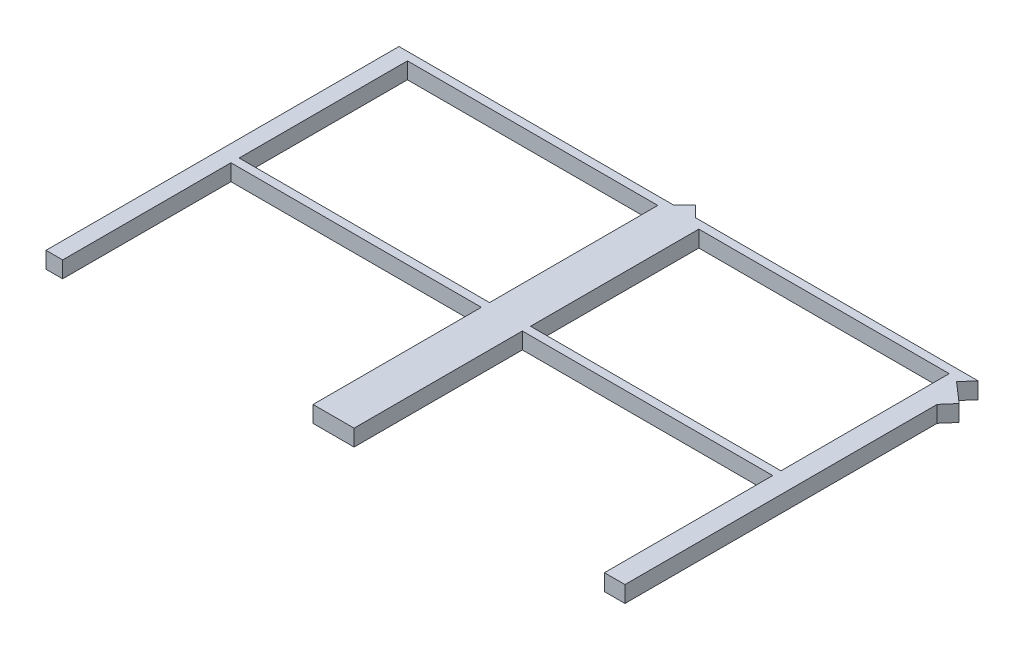
from build123d import *

# Parameters (mm, degrees)
SKETCH1_W           = 77.47
SKETCH1_H           = 52.07
BOSS_EXTRUDE4_DEPTH = 5.08
CUT_EXTRUDE9_DEPTH  = 5.08
CUT_EXTRUDE10_DEPTH = 5.08


with BuildPart() as part:
    # Sketch1 → Boss-Extrude4 (new body)
    with BuildSketch(Plane(origin=(0, 0, 0), x_dir=(1, 0, 0), z_dir=(0, 1, 0))):
        Polygon((-151.207591036, -110.49), (-146.05, -110.49), (-146.05, -58.42), (-68.58, -58.42), (-68.58, -110.49), (-55.88, -110.49), (-55.88, -58.42), (21.59, -58.42), (21.59, -110.49), (34.29, -110.49), (34.29, -58.42), (111.76, -58.42), (111.76, -110.49), (151.052408964, -110.49), (151.052408964, 110.49), (-151.207591036, 110.49), align=None)
        with Locations((-107.315, -29.845)):
            Rectangle(SKETCH1_W, SKETCH1_H, mode=Mode.SUBTRACT)
        with Locations((-17.145, -29.845)):
            Rectangle(SKETCH1_W, SKETCH1_H, mode=Mode.SUBTRACT)
        with Locations((73.025, -29.845)):
            Rectangle(SKETCH1_W, SKETCH1_H, mode=Mode.SUBTRACT)
        with Locations((-107.315, 24.765)):
            Rectangle(SKETCH1_W, SKETCH1_H, mode=Mode.SUBTRACT)
        with Locations((-17.145, 24.765)):
            Rectangle(SKETCH1_W, SKETCH1_H, mode=Mode.SUBTRACT)
        with Locations((-107.315, 79.375)):
            Rectangle(SKETCH1_W, SKETCH1_H, mode=Mode.SUBTRACT)
        with Locations((-17.145, 79.375)):
            Rectangle(SKETCH1_W, SKETCH1_H, mode=Mode.SUBTRACT)
        with Locations((73.025, 24.765)):
            Rectangle(SKETCH1_W, SKETCH1_H, mode=Mode.SUBTRACT)
        with Locations((73.025, 79.375)):
            Rectangle(SKETCH1_W, SKETCH1_H, mode=Mode.SUBTRACT)
    extrude(amount=BOSS_EXTRUDE4_DEPTH)

    # Sketch8 → Cut-Extrude9 (cut)
    # profile 1 of 7: a face of its own
    with BuildSketch(Plane(origin=(0, 5.08, 0), x_dir=(1, 0, 0), z_dir=(0, 1, 0))):
        Polygon((118.11, 79.293589744), (111.76, 76.362820513), (111.76, 76.982301683), (113.79525641, 77.921063702), (113.79525641, 80.799679487), (111.76, 81.765154247), (111.76, 82.387179487), (118.11, 79.375), align=None)
        Polygon((116.872309696, 79.340655048), (114.446538462, 80.49057492), (114.446538462, 78.221264022), align=None, mode=Mode.SUBTRACT)
    # profile 2 of 7: a face of its own
    with BuildSketch(Plane(origin=(0, 5.08, 0), x_dir=(1, 0, 0), z_dir=(0, 1, 0))):
        with BuildLine():
            Line((118.11, 26.474615385), (118.11, 25.235653045))
            add(Edge.make_bspline(
                [(118.11, 25.235653045), (118.109681139, 25.175004234), (118.109063106, 25.057451746), (118.099477996, 24.886510758), (118.086408481, 24.726402202), (118.065671027, 24.577079644), (118.040648803, 24.438612083), (118.010346937, 24.310582227), (117.974012938, 24.193397201), (117.916234684, 24.053492664), (117.830376936, 23.893979465), (117.703506539, 23.721262382), (117.548326213, 23.573571833), (117.37327911, 23.4462338), (117.180718496, 23.344994626), (116.975233967, 23.271753187), (116.75947595, 23.225383899), (116.611351899, 23.220615168), (116.536492388, 23.218205128)],
                knots=[0, 0, 0, 0, 1.001505555, 1.941167018, 2.826882275, 3.653841531, 4.429895133, 5.150066043, 5.825578002, 6.45369114, 7.647487171, 8.808567382, 9.977351308, 11.170798116, 12.373658725, 13.556498008, 14.765093433, 16, 16, 16, 16], degree=3))
            add(Edge.make_bspline(
                [(116.536492388, 23.218205128), (116.466353726, 23.220150205), (116.328524642, 23.223972465), (116.12725909, 23.261767034), (115.934882118, 23.318037757), (115.753765338, 23.399726219), (115.586236491, 23.504802861), (115.433291194, 23.631250472), (115.29863595, 23.781802882), (115.223670167, 23.894781468), (115.185590946, 23.952169471)],
                knots=[0, 0, 0, 0, 1.044266239, 2.052081639, 3.041743201, 4.026043445, 5.00270663, 5.980942822, 6.97441044, 8, 8, 8, 8], degree=3))
            add(Edge.make_bspline(
                [(115.185590946, 23.952169471), (115.157917248, 23.880020614), (115.10497061, 23.741981978), (115.010852235, 23.551885993), (114.90963819, 23.387448746), (114.798522364, 23.248489243), (114.677253559, 23.131437365), (114.548260115, 23.026322349), (114.405191505, 22.938259533), (114.252121508, 22.862606152), (114.090124446, 22.803067733), (113.919941192, 22.760940396), (113.743474705, 22.735055197), (113.623194862, 22.731525492), (113.562473958, 22.72974359)],
                knots=[0, 0, 0, 0, 1.272302504, 2.434229863, 3.488457646, 4.447234501, 5.35599188, 6.26022912, 7.18267843, 8.11661068, 9.06895546, 10.019249207, 11.000057067, 12, 12, 12, 12], degree=3))
            add(Edge.make_bspline(
                [(113.562473958, 22.72974359), (113.500485842, 22.731516424), (113.378522486, 22.735004524), (113.199347436, 22.7607231), (113.028142769, 22.804311677), (112.863691196, 22.864204763), (112.70692357, 22.942816916), (112.555876508, 23.036423505), (112.414573802, 23.150354586), (112.279655118, 23.277346904), (112.158418428, 23.421179366), (112.05048411, 23.576340817), (111.961311987, 23.745062992), (111.887341532, 23.924729456), (111.830014808, 24.116534097), (111.790215937, 24.31976575), (111.763336967, 24.53446858), (111.761131196, 24.681807332), (111.76, 24.757367788)],
                knots=[0, 0, 0, 0, 0.978404568, 1.925038397, 2.85041836, 3.763147166, 4.682162379, 5.614488577, 6.562659439, 7.54271123, 8.535210642, 9.526693784, 10.520907202, 11.541451354, 12.589717429, 13.675358278, 14.807842563, 16, 16, 16, 16], degree=3))
            Line((111.76, 24.757367788), (111.76, 26.474615385))
            Line((111.76, 26.474615385), (118.11, 26.474615385))
        make_face()
        with BuildLine():
            Line((117.458717949, 25.90474359), (115.423461538, 25.90474359))
            Line((115.423461538, 25.90474359), (115.423461538, 25.521860978))
            add(Edge.make_bspline(
                [(115.423461538, 25.521860978), (115.424181075, 25.465891945), (115.425571367, 25.357748368), (115.429679415, 25.200723225), (115.440678409, 25.055331233), (115.452311659, 24.921071395), (115.470224485, 24.798843581), (115.49214475, 24.688238604), (115.515124768, 24.588262886), (115.554315522, 24.473021329), (115.611648095, 24.342338932), (115.702715767, 24.203911992), (115.808237502, 24.079896012), (115.932241327, 23.976344233), (116.067626032, 23.890895914), (116.214403686, 23.833871415), (116.366844139, 23.793424687), (116.471770578, 23.789877771), (116.525044071, 23.788076923)],
                knots=[0, 0, 0, 0, 1.156481963, 2.23455883, 3.244418989, 4.168404366, 5.01828131, 5.794834307, 6.498111525, 7.13526334, 8.307595709, 9.435046769, 10.546766856, 11.659452936, 12.760769924, 13.837671619, 14.902137667, 16, 16, 16, 16], degree=3))
            add(Edge.make_bspline(
                [(116.525044071, 23.788076923), (116.56030457, 23.788977603), (116.629471889, 23.790744385), (116.729913527, 23.8068242), (116.82558773, 23.830156168), (116.914294057, 23.866607821), (116.998553798, 23.910685404), (117.074624411, 23.96802234), (117.1466735, 24.032775181), (117.212055599, 24.108821091), (117.270638216, 24.195791849), (117.322185781, 24.294516129), (117.362847974, 24.406172748), (117.399324126, 24.528230019), (117.4246346, 24.66264136), (117.445797527, 24.808093389), (117.456555228, 24.965820019), (117.457980962, 25.074940101), (117.458717949, 25.131346154)],
                knots=[0, 0, 0, 0, 0.911752476, 1.788502045, 2.626783689, 3.45400582, 4.26402138, 5.080402872, 5.911472738, 6.767166405, 7.66795952, 8.620018292, 9.640966946, 10.73819047, 11.913090943, 13.176185384, 14.540321519, 16, 16, 16, 16], degree=3))
            Line((117.458717949, 25.131346154), (117.458717949, 25.90474359))
        make_face(mode=Mode.SUBTRACT)
        with BuildLine():
            Line((114.772179487, 25.90474359), (112.411282051, 25.90474359))
            Line((112.411282051, 25.90474359), (112.411282051, 25.093185096))
            add(Edge.make_bspline(
                [(112.411282051, 25.093185096), (112.411975847, 25.035093328), (112.413313047, 24.923129104), (112.417726104, 24.761477849), (112.427553327, 24.612056238), (112.443574322, 24.47477829), (112.460221531, 24.348435585), (112.483262073, 24.23428334), (112.509456384, 24.132146551), (112.549993321, 24.013731405), (112.612860676, 23.880302727), (112.708268617, 23.736613475), (112.820435778, 23.607586425), (112.95189156, 23.499274679), (113.093745082, 23.409835086), (113.245254404, 23.347105881), (113.401797428, 23.306771901), (113.508807295, 23.302005692), (113.562473958, 23.299615385)],
                knots=[0, 0, 0, 0, 1.159821618, 2.235403267, 3.228114831, 4.14795534, 4.994323282, 5.771256229, 6.471395042, 7.097801288, 8.267864287, 9.404187171, 10.531774336, 11.667624178, 12.792825787, 13.866573821, 14.930062559, 16, 16, 16, 16], degree=3))
            add(Edge.make_bspline(
                [(113.562473958, 23.299615385), (113.596030503, 23.300103956), (113.662602321, 23.301073218), (113.760357737, 23.31624054), (113.855472736, 23.337399943), (113.946509043, 23.368040578), (114.034948011, 23.406675936), (114.119249173, 23.455161844), (114.2014282, 23.511153881), (114.305201688, 23.598743929), (114.42480707, 23.726024945), (114.541892162, 23.906931894), (114.636322991, 24.112618706), (114.676417579, 24.261803289), (114.697129407, 24.338868189)],
                knots=[0, 0, 0, 0, 0.723503378, 1.435336582, 2.130201219, 2.824764462, 3.504949994, 4.209866579, 4.920640069, 5.648298893, 7.13757748, 8.670694625, 10.280166878, 12, 12, 12, 12], degree=3))
            add(Edge.make_bspline(
                [(114.697129407, 24.338868189), (114.703398338, 24.369763806), (114.716990673, 24.436751875), (114.731329404, 24.545986183), (114.744191712, 24.671110852), (114.753456167, 24.811591078), (114.763401398, 24.967985569), (114.767131466, 25.140244081), (114.771684212, 25.328488394), (114.772010172, 25.459103286), (114.772179487, 25.526949119)],
                knots=[0, 0, 0, 0, 0.634452549, 1.375623993, 2.216454381, 3.166361212, 4.209414599, 5.370755378, 6.634280627, 8, 8, 8, 8], degree=3))
            Line((114.772179487, 25.526949119), (114.772179487, 25.90474359))
        make_face(mode=Mode.SUBTRACT)
    # profile 3 of 7: a face of its own
    with BuildSketch(Plane(origin=(0, 5.08, 0), x_dir=(1, 0, 0), z_dir=(0, 1, 0))):
        with BuildLine():
            Line((116.944815705, -32.938589744), (116.563205128, -32.439951923))
            add(Edge.make_bspline(
                [(116.563205128, -32.439951923), (116.605597673, -32.40438124), (116.689811221, -32.333719444), (116.808065537, -32.220037748), (116.918855368, -32.10156191), (117.022708493, -31.978337218), (117.115993196, -31.848145673), (117.203570769, -31.714141081), (117.282070808, -31.574081771), (117.377253654, -31.380403623), (117.476578821, -31.127042527), (117.559860398, -30.808100462), (117.612875959, -30.475158898), (117.618617886, -30.248014681), (117.621538462, -30.132479968)],
                knots=[0, 0, 0, 0, 0.757959112, 1.505699292, 2.245454638, 2.979532153, 3.711538275, 4.438200793, 5.171680507, 5.909471876, 7.393775596, 8.890124382, 10.418191784, 12, 12, 12, 12], degree=3))
            add(Edge.make_bspline(
                [(117.621538462, -30.132479968), (117.620802251, -30.068829613), (117.619336663, -29.942119638), (117.600137483, -29.754060275), (117.572842033, -29.56915638), (117.533326202, -29.388095544), (117.481880175, -29.211237272), (117.421547717, -29.037234935), (117.346470096, -28.868137816), (117.263556886, -28.701910874), (117.169880198, -28.542661658), (117.067735433, -28.391952614), (116.958125128, -28.250472259), (116.84133222, -28.117828549), (116.715905207, -27.995476207), (116.58331959, -27.881454356), (116.441979536, -27.777817938), (116.294535759, -27.682020268), (116.140771545, -27.596777475), (115.9816542, -27.523166197), (115.817792087, -27.46007521), (115.648849522, -27.409690045), (115.475491338, -27.369948117), (115.297349628, -27.342492588), (115.114770175, -27.323466123), (114.991019157, -27.322014016), (114.928639824, -27.321282051)],
                knots=[0, 0, 0, 0, 1.055000685, 2.100209969, 3.131349012, 4.153242145, 5.170189196, 6.184191144, 7.204341339, 8.235672124, 9.263040994, 10.265373269, 11.252624173, 12.22887325, 13.193405896, 14.155809299, 15.126090485, 16.097288279, 17.069732292, 18.038585918, 19.002221264, 19.978698174, 20.959418239, 21.948869816, 22.966084182, 24, 24, 24, 24], degree=3))
            add(Edge.make_bspline(
                [(114.928639824, -27.321282051), (114.834784429, -27.323571352), (114.650511811, -27.328066089), (114.380599417, -27.368068066), (114.122026195, -27.428855875), (113.876408481, -27.519961279), (113.640717603, -27.632300128), (113.418941397, -27.774250951), (113.207728487, -27.938655241), (113.012070568, -28.12783883), (112.833338524, -28.335403668), (112.675948183, -28.55810345), (112.544748325, -28.795383515), (112.435571964, -29.044623973), (112.351649044, -29.307742779), (112.29256842, -29.584266778), (112.254029036, -29.873594541), (112.250339344, -30.071296166), (112.248461538, -30.171913061)],
                knots=[0, 0, 0, 0, 1.029171465, 2.020641659, 2.987623507, 3.938342917, 4.889210282, 5.84687017, 6.821220943, 7.821438502, 8.827599549, 9.822697543, 10.807740252, 11.797342354, 12.80366471, 13.83203677, 14.896651826, 16, 16, 16, 16], degree=3))
            add(Edge.make_bspline(
                [(112.248461538, -30.171913061), (112.251525467, -30.282770797), (112.257556013, -30.50096534), (112.308644936, -30.820947331), (112.391481444, -31.127263648), (112.507410532, -31.41993077), (112.658114697, -31.698123628), (112.840809417, -31.962277569), (113.057232535, -32.212615561), (113.222483354, -32.363149173), (113.306794872, -32.439951923)],
                knots=[0, 0, 0, 0, 1.028121516, 2.023589091, 2.998037872, 3.967518031, 4.937445131, 5.927275754, 6.942489185, 8, 8, 8, 8], degree=3))
            Line((113.306794872, -32.439951923), (112.929000401, -32.938589744))
            add(Edge.make_bspline(
                [(112.929000401, -32.938589744), (112.877223407, -32.898461226), (112.773917427, -32.818396404), (112.628282924, -32.688750355), (112.491292127, -32.552178781), (112.36407883, -32.407649584), (112.243987323, -32.256891333), (112.135043577, -32.097248498), (112.033928993, -31.93147842), (111.942568033, -31.758615962), (111.860652906, -31.579228654), (111.791497891, -31.393503181), (111.731069307, -31.20301302), (111.681684053, -31.007662239), (111.643076564, -30.806798224), (111.617282312, -30.601110145), (111.599606535, -30.390163816), (111.597995761, -30.247848605), (111.597179487, -30.175729167)],
                knots=[0, 0, 0, 0, 0.986756325, 1.968786143, 2.935506311, 3.899499537, 4.868307269, 5.8376204, 6.809456583, 7.792545619, 8.781780509, 9.778496008, 10.776623214, 11.79151764, 12.812666265, 13.856269958, 14.913646641, 16, 16, 16, 16], degree=3))
            add(Edge.make_bspline(
                [(111.597179487, -30.175729167), (111.597654817, -30.107432799), (111.598594721, -29.97238519), (111.613820511, -29.772997455), (111.634593605, -29.578887787), (111.665872129, -29.390610966), (111.702782574, -29.207139554), (111.752260425, -29.030136779), (111.807685342, -28.857860898), (111.872827246, -28.691004051), (111.946335178, -28.52942431), (112.029414149, -28.373642823), (112.121365532, -28.223731239), (112.220162479, -28.07821569), (112.328978441, -27.939245788), (112.446302192, -27.805617249), (112.571738298, -27.676580756), (112.662189246, -27.596747314), (112.707666266, -27.556608574)],
                knots=[0, 0, 0, 0, 1.114604814, 2.203992996, 3.262667896, 4.300477797, 5.318619304, 6.316056647, 7.298880507, 8.271930387, 9.238335007, 10.195173496, 11.151986948, 12.108099108, 13.064862484, 14.031167946, 15.010108607, 16, 16, 16, 16], degree=3))
            add(Edge.make_bspline(
                [(112.707666266, -27.556608574), (112.786662423, -27.492318192), (112.943701026, -27.364513598), (113.198219878, -27.200999858), (113.463955057, -27.061032151), (113.742302642, -26.947864409), (114.032638045, -26.859394879), (114.335107621, -26.798106139), (114.649428887, -26.758279657), (114.86321849, -26.753725276), (114.971889022, -26.751410256)],
                knots=[0, 0, 0, 0, 0.994628077, 1.977248131, 2.950237994, 3.925870899, 4.908910175, 5.911660606, 6.938484602, 8, 8, 8, 8], degree=3))
            add(Edge.make_bspline(
                [(114.971889022, -26.751410256), (115.086103424, -26.754244442), (115.310813128, -26.759820525), (115.640671219, -26.806804203), (115.956243845, -26.883302707), (116.258745252, -26.988641657), (116.546444643, -27.127611896), (116.820557094, -27.295846609), (117.080858784, -27.494989044), (117.324021732, -27.72253816), (117.546337205, -27.97213776), (117.741930009, -28.239412742), (117.904702809, -28.523860895), (118.040767384, -28.82234304), (118.145350881, -29.137095699), (118.218563099, -29.467446937), (118.264132722, -29.812776116), (118.269893457, -30.048383659), (118.272820513, -30.168096955)],
                knots=[0, 0, 0, 0, 1.032901378, 2.032168977, 3.007206631, 3.966850309, 4.924221947, 5.891988639, 6.871730993, 7.884084801, 8.900290346, 9.89161143, 10.874607481, 11.860025555, 12.854717796, 13.869097222, 14.917278314, 16, 16, 16, 16], degree=3))
            add(Edge.make_bspline(
                [(118.272820513, -30.168096955), (118.27194643, -30.24105764), (118.270216271, -30.385475968), (118.253322795, -30.599110851), (118.225211517, -30.807112405), (118.186697164, -31.009983654), (118.139491479, -31.208460249), (118.077695589, -31.40050597), (118.005935411, -31.587166578), (117.925394904, -31.768581871), (117.833318651, -31.942778105), (117.733314188, -32.109723579), (117.623073079, -32.267404402), (117.506239897, -32.418786561), (117.378444314, -32.560461963), (117.243848093, -32.696476823), (117.098457292, -32.822132675), (116.996123317, -32.89969966), (116.944815705, -32.938589744)],
                knots=[0, 0, 0, 0, 1.096705196, 2.170817488, 3.219277236, 4.250701065, 5.274195539, 6.284202015, 7.28098643, 8.279664616, 9.266225751, 10.241373748, 11.203306326, 12.157093976, 13.114198862, 14.069774147, 15.032234603, 16, 16, 16, 16], degree=3))
        make_face()
    # profile 4 of 7: a face of its own
    with BuildSketch(Plane(origin=(0, 5.08, 0), x_dir=(1, 0, 0), z_dir=(0, 1, 0))):
        with BuildLine():
            Line((111.76, -82.012692308), (118.11, -82.012692308))
            Line((118.11, -82.012692308), (118.11, -83.294903846))
            add(Edge.make_bspline(
                [(118.11, -83.294903846), (118.10919924, -83.406426385), (118.107652175, -83.62188735), (118.097786915, -83.933238257), (118.080511466, -84.220906485), (118.054862343, -84.484728674), (118.024076207, -84.725128674), (117.984923928, -84.941721457), (117.938878197, -85.134858028), (117.899605318, -85.253638066), (117.881033654, -85.309807692)],
                knots=[0, 0, 0, 0, 1.314317071, 2.539253741, 3.67075822, 4.709970291, 5.662644612, 6.526156501, 7.303037452, 8, 8, 8, 8], degree=3))
            add(Edge.make_bspline(
                [(117.881033654, -85.309807692), (117.853037914, -85.383276673), (117.797681284, -85.528548601), (117.693258165, -85.735390771), (117.574941266, -85.930107124), (117.44258475, -86.11375686), (117.2924032, -86.282089414), (117.130916153, -86.441891296), (116.951524797, -86.585988874), (116.760320009, -86.720164865), (116.555362101, -86.837571052), (116.340810785, -86.941109671), (116.117067511, -87.029513574), (115.882503759, -87.098492965), (115.639371325, -87.15548169), (115.385829701, -87.193719768), (115.123356971, -87.219119775), (114.945238152, -87.221659883), (114.854861779, -87.222948718)],
                knots=[0, 0, 0, 0, 0.98467389, 1.947018643, 2.898343565, 3.837828625, 4.779009928, 5.722093987, 6.681368302, 7.658573986, 8.646467994, 9.637429229, 10.641859304, 11.657149908, 12.698561448, 13.768651538, 14.867827761, 16, 16, 16, 16], degree=3))
            add(Edge.make_bspline(
                [(114.854861779, -87.222948718), (114.776373797, -87.221806822), (114.621705032, -87.219556598), (114.39375275, -87.199375846), (114.172580583, -87.169987158), (113.959159893, -87.124695693), (113.752052982, -87.069043404), (113.552243376, -87.000351318), (113.359584615, -86.918944546), (113.175646042, -86.82449634), (113.000731948, -86.721221421), (112.837852299, -86.607986514), (112.683909336, -86.491289421), (112.545846691, -86.362132049), (112.415768103, -86.229414775), (112.300701958, -86.08609986), (112.195636064, -85.936856417), (112.101337325, -85.778809783), (112.019522725, -85.608171823), (111.94943361, -85.422613554), (111.891722261, -85.221141181), (111.843495333, -85.004063511), (111.805260876, -84.770955192), (111.779629867, -84.521602395), (111.762298604, -84.256383924), (111.760781079, -84.074267288), (111.76, -83.980530849)],
                knots=[0, 0, 0, 0, 1.105818345, 2.179130549, 3.222742436, 4.24813173, 5.251184997, 6.243232575, 7.223185975, 8.195898781, 9.155064964, 10.083206407, 10.990357329, 11.874224667, 12.744762365, 13.607037788, 14.46074101, 15.315384698, 16.197310979, 17.123950979, 18.107232398, 19.148086642, 20.256146639, 21.433991621, 22.679261309, 24, 24, 24, 24], degree=3))
            Line((111.76, -83.980530849), (111.76, -82.012692308))
        make_face()
        with BuildLine():
            Line((112.411282051, -82.582564103), (112.411282051, -83.311440304))
            add(Edge.make_bspline(
                [(112.411282051, -83.311440304), (112.411732169, -83.416176063), (112.41259791, -83.617621283), (112.420194693, -83.907286506), (112.432607922, -84.171953411), (112.449979849, -84.411659579), (112.472964337, -84.626269665), (112.498590946, -84.816232183), (112.53051775, -84.980924438), (112.559457347, -85.08058213), (112.572830529, -85.126634615)],
                knots=[0, 0, 0, 0, 1.375205317, 2.645023457, 3.804390687, 4.853969522, 5.800190428, 6.637939096, 7.370582563, 8, 8, 8, 8], degree=3))
            add(Edge.make_bspline(
                [(112.572830529, -85.126634615), (112.593242549, -85.184599298), (112.633579048, -85.299144178), (112.707184232, -85.464010709), (112.794265109, -85.61784952), (112.891632722, -85.763227177), (113.000795015, -85.899202305), (113.122082386, -86.02517169), (113.254153497, -86.142030641), (113.397503093, -86.248500834), (113.551204387, -86.34363756), (113.713300631, -86.426559757), (113.883400607, -86.496918019), (114.062117399, -86.554129451), (114.249282549, -86.598465023), (114.444403664, -86.63000926), (114.647541614, -86.649619319), (114.785702691, -86.651909464), (114.856133814, -86.653076923)],
                knots=[0, 0, 0, 0, 0.998463025, 1.973077781, 2.929496817, 3.867873318, 4.813809365, 5.759268434, 6.706333209, 7.676553387, 8.657505312, 9.640584699, 10.632319813, 11.645628493, 12.686877747, 13.755137172, 14.855624085, 16, 16, 16, 16], degree=3))
            add(Edge.make_bspline(
                [(114.856133814, -86.653076923), (114.930398398, -86.652144681), (115.07629183, -86.650313282), (115.290366967, -86.627332533), (115.49623045, -86.593678155), (115.694030492, -86.545268959), (115.88350975, -86.482728451), (116.065738702, -86.407893664), (116.238372234, -86.317032486), (116.402872487, -86.214168026), (116.556748208, -86.098683831), (116.698196661, -85.971092184), (116.827481331, -85.832738462), (116.94480806, -85.684260293), (117.048090353, -85.523581703), (117.139968669, -85.353421689), (117.218033951, -85.17138332), (117.259539698, -85.044720759), (117.280633013, -84.980350561)],
                knots=[0, 0, 0, 0, 1.122272916, 2.204715076, 3.251197285, 4.274229216, 5.279697671, 6.265416158, 7.248880903, 8.225321784, 9.195852973, 10.153576302, 11.101466393, 12.055578741, 13.010401466, 13.985536859, 14.976245305, 16, 16, 16, 16], degree=3))
            add(Edge.make_bspline(
                [(117.280633013, -84.980350561), (117.295358532, -84.927099195), (117.326669026, -84.813872182), (117.36082363, -84.629106297), (117.390948936, -84.421161669), (117.416454236, -84.189115068), (117.434755519, -83.933231006), (117.448492047, -83.653312687), (117.457756937, -83.349239119), (117.458389591, -83.138450807), (117.458717949, -83.029048478)],
                knots=[0, 0, 0, 0, 0.674548936, 1.434276114, 2.292660221, 3.240891867, 4.284742987, 5.42552168, 6.663806718, 8, 8, 8, 8], degree=3))
            Line((117.458717949, -83.029048478), (117.458717949, -82.582564103))
            Line((117.458717949, -82.582564103), (112.411282051, -82.582564103))
        make_face(mode=Mode.SUBTRACT)
    # profile 5 of 7: a face of its own
    with BuildSketch(Plane(origin=(0, 5.08, 0), x_dir=(1, 0, 0), z_dir=(0, 1, 0))):
        with BuildLine():
            Line((-108.006987179, 107.852307692), (-108.291923077, 107.852307692))
            add(Edge.make_bspline(
                [(-108.291923077, 107.852307692), (-108.284203699, 107.884268588), (-108.269112946, 107.946749526), (-108.23763729, 108.03601897), (-108.203347966, 108.120495307), (-108.162173564, 108.198596746), (-108.117262051, 108.271892893), (-108.065806439, 108.338721313), (-108.010180691, 108.400781646), (-107.948653773, 108.455857226), (-107.884129915, 108.50572988), (-107.815699939, 108.548252254), (-107.7447406, 108.584832021), (-107.670760258, 108.614967517), (-107.593538659, 108.637669242), (-107.513773929, 108.654140059), (-107.43125704, 108.664836284), (-107.375243154, 108.66588019), (-107.346800881, 108.666410256)],
                knots=[0, 0, 0, 0, 1.162005537, 2.271625781, 3.343758855, 4.383309926, 5.390229558, 6.379919256, 7.361854164, 8.333198761, 9.295911338, 10.242430842, 11.177959212, 12.116337295, 13.062827104, 14.020064771, 14.994644689, 16, 16, 16, 16], degree=3))
            add(Edge.make_bspline(
                [(-107.346800881, 108.666410256), (-107.305360108, 108.665159098), (-107.223382505, 108.662684071), (-107.102947456, 108.640083118), (-106.986808841, 108.604318891), (-106.876237881, 108.554903438), (-106.773532588, 108.493954947), (-106.682150476, 108.421415507), (-106.603330184, 108.338684712), (-106.53720457, 108.247305886), (-106.485429392, 108.14964696), (-106.447251039, 108.049135389), (-106.424008514, 107.9460096), (-106.420996295, 107.876379783), (-106.419487179, 107.841495393)],
                knots=[0, 0, 0, 0, 1.083050992, 2.142477498, 3.193116406, 4.255571735, 5.30263384, 6.308962982, 7.297363603, 8.282367274, 9.249857812, 10.179914175, 11.08814088, 12, 12, 12, 12], degree=3))
            add(Edge.make_bspline(
                [(-106.419487179, 107.841495393), (-106.420542723, 107.807924943), (-106.422608257, 107.742232783), (-106.44014669, 107.646328282), (-106.469661729, 107.555939116), (-106.510546442, 107.470684776), (-106.563470562, 107.391105814), (-106.627580795, 107.317023185), (-106.703329638, 107.248108306), (-106.760732674, 107.208629927), (-106.790285457, 107.188305288)],
                knots=[0, 0, 0, 0, 1.024540389, 2.004866551, 2.965041327, 3.920577974, 4.882998113, 5.874504559, 6.905732034, 8, 8, 8, 8], degree=3))
            add(Edge.make_bspline(
                [(-106.790285457, 107.188305288), (-106.756510937, 107.171996519), (-106.689593843, 107.139684128), (-106.598380149, 107.076314977), (-106.515578076, 107.003148148), (-106.469401131, 106.94605017), (-106.44619992, 106.917361779)],
                knots=[0, 0, 0, 0, 1.015518401, 2.012035669, 3.001164323, 4, 4, 4, 4], degree=3))
            add(Edge.make_bspline(
                [(-106.44619992, 106.917361779), (-106.430922416, 106.896445104), (-106.400617589, 106.85495428), (-106.363211069, 106.788246236), (-106.329275659, 106.720798814), (-106.302832245, 106.65080421), (-106.282354523, 106.57907369), (-106.267716837, 106.505484088), (-106.258623509, 106.429975311), (-106.257321258, 106.378891847), (-106.256666667, 106.353214143)],
                knots=[0, 0, 0, 0, 1.025084078, 2.033381695, 3.024893161, 4.013698104, 4.991890475, 5.976764909, 6.982997093, 8, 8, 8, 8], degree=3))
            add(Edge.make_bspline(
                [(-106.256666667, 106.353214143), (-106.258294547, 106.308755324), (-106.261542646, 106.220046911), (-106.290574914, 106.088987699), (-106.335581211, 105.960875994), (-106.399495717, 105.838343818), (-106.477389814, 105.723698758), (-106.570061101, 105.621122392), (-106.676456629, 105.532949372), (-106.795116039, 105.459280094), (-106.923673719, 105.400390265), (-107.061174435, 105.359516727), (-107.205636984, 105.332895713), (-107.304703604, 105.330041054), (-107.355069111, 105.328589744)],
                knots=[0, 0, 0, 0, 0.955779014, 1.907060117, 2.875433937, 3.871313158, 4.872415639, 5.851225146, 6.836215519, 7.83643374, 8.849228613, 9.86973379, 10.916971861, 12, 12, 12, 12], degree=3))
            add(Edge.make_bspline(
                [(-107.355069111, 105.328589744), (-107.389013762, 105.329377337), (-107.455805515, 105.330927058), (-107.553997832, 105.341521218), (-107.647725373, 105.36087058), (-107.737114866, 105.386908578), (-107.82224572, 105.419921087), (-107.902858158, 105.46103162), (-107.979448133, 105.509392769), (-108.051292896, 105.565575381), (-108.118383883, 105.628423453), (-108.17893814, 105.699052698), (-108.233965237, 105.776157486), (-108.281991774, 105.860633401), (-108.325205295, 105.951388741), (-108.36074802, 106.049585593), (-108.392031357, 106.154346099), (-108.406576, 106.227350906), (-108.414038462, 106.264807692)],
                knots=[0, 0, 0, 0, 1.048658725, 2.063410685, 3.046034179, 4.001477787, 4.936774919, 5.862367409, 6.792675028, 7.730719943, 8.675894397, 9.627829632, 10.600096036, 11.597688215, 12.626045268, 13.701542398, 14.82072376, 16, 16, 16, 16], degree=3))
            Line((-108.414038462, 106.264807692), (-108.129102564, 106.264807692))
            add(Edge.make_bspline(
                [(-108.129102564, 106.264807692), (-108.12167915, 106.240361087), (-108.107239964, 106.192810317), (-108.082661565, 106.124375183), (-108.054659633, 106.061638949), (-108.024619997, 106.004141403), (-107.993070978, 105.951316295), (-107.957769582, 105.904560456), (-107.921330429, 105.861820237), (-107.89386273, 105.837740482), (-107.880419671, 105.825955529)],
                knots=[0, 0, 0, 0, 1.198163088, 2.33053128, 3.407730985, 4.417276592, 5.372219308, 6.28897303, 7.162600585, 8, 8, 8, 8], degree=3))
            add(Edge.make_bspline(
                [(-107.880419671, 105.825955529), (-107.862642777, 105.812250112), (-107.827143861, 105.784881583), (-107.769296966, 105.749955106), (-107.708459534, 105.71969189), (-107.643313365, 105.696574537), (-107.575264252, 105.677000516), (-107.503212285, 105.664191188), (-107.427793138, 105.655402633), (-107.376296667, 105.654627088), (-107.34998097, 105.654230769)],
                knots=[0, 0, 0, 0, 0.946170439, 1.889420265, 2.845303464, 3.807233317, 4.801018734, 5.828864929, 6.890507805, 8, 8, 8, 8], degree=3))
            add(Edge.make_bspline(
                [(-107.34998097, 105.654230769), (-107.320268864, 105.654789483), (-107.262169405, 105.655882), (-107.177392497, 105.665929249), (-107.096740741, 105.680561838), (-107.021109587, 105.703161472), (-106.949508341, 105.731084102), (-106.882940702, 105.766143727), (-106.820532806, 105.807277867), (-106.763083988, 105.854031247), (-106.711426277, 105.905213603), (-106.665942576, 105.958746889), (-106.627275919, 106.014405392), (-106.596085101, 106.072497116), (-106.571455674, 106.132781502), (-106.55468877, 106.195427726), (-106.54303061, 106.259923103), (-106.542081183, 106.303764382), (-106.541602564, 106.325865385)],
                knots=[0, 0, 0, 0, 1.217147791, 2.380027433, 3.494444702, 4.572153297, 5.609568379, 6.639424714, 7.649109417, 8.668170816, 9.669597737, 10.625200337, 11.543417969, 12.441394052, 13.322311151, 14.205496177, 15.095365482, 16, 16, 16, 16], degree=3))
            add(Edge.make_bspline(
                [(-106.541602564, 106.325865385), (-106.542990766, 106.355448528), (-106.545760263, 106.414467612), (-106.566904474, 106.501297126), (-106.601683301, 106.584956936), (-106.650371936, 106.664019688), (-106.709640776, 106.737294971), (-106.778914656, 106.802674101), (-106.858768834, 106.856621969), (-106.93226543, 106.893895251), (-106.997366679, 106.919328883), (-107.053079206, 106.936269744), (-107.115451268, 106.950614988), (-107.183728599, 106.96396112), (-107.258425659, 106.975319772), (-107.339461128, 106.984791991), (-107.426851426, 106.992371206), (-107.487349841, 106.995755843), (-107.518525641, 106.9975)],
                knots=[0, 0, 0, 0, 1.07054697, 2.135767047, 3.216561865, 4.33974944, 5.486079747, 6.621378074, 7.775625952, 8.963672916, 9.598146892, 10.304877434, 11.070270905, 11.915000392, 12.823868403, 13.805723172, 14.86925407, 16, 16, 16, 16], degree=3))
            Line((-107.518525641, 106.9975), (-107.518525641, 107.323141026))
            add(Edge.make_bspline(
                [(-107.518525641, 107.323141026), (-107.479245298, 107.323807598), (-107.402304755, 107.325113248), (-107.289914921, 107.340904801), (-107.182442702, 107.36274937), (-107.082269872, 107.396209509), (-106.990967111, 107.435071778), (-106.911755757, 107.480294854), (-106.84574556, 107.530563948), (-106.793257302, 107.586654958), (-106.753770073, 107.64681218), (-106.724898621, 107.709510862), (-106.707844039, 107.775300546), (-106.705567413, 107.82019928), (-106.704423077, 107.842767428)],
                knots=[0, 0, 0, 0, 1.321986639, 2.589447074, 3.816329219, 5.01088745, 6.139805852, 7.153945165, 8.075214402, 8.924034688, 9.728124013, 10.488707548, 11.240355623, 12, 12, 12, 12], degree=3))
            add(Edge.make_bspline(
                [(-106.704423077, 107.842767428), (-106.704799007, 107.859347954), (-106.705546902, 107.892334124), (-106.714978718, 107.94052615), (-106.729151955, 107.987244866), (-106.748637138, 108.032291594), (-106.774717676, 108.075353913), (-106.80592882, 108.116798956), (-106.84309274, 108.156390099), (-106.885678967, 108.19329296), (-106.931409676, 108.228462197), (-106.981529114, 108.258319567), (-107.034526101, 108.283851159), (-107.090459309, 108.304905493), (-107.149510255, 108.320743562), (-107.211401489, 108.332115361), (-107.27625103, 108.339225234), (-107.320493959, 108.340248868), (-107.342984776, 108.340769231)],
                knots=[0, 0, 0, 0, 0.884392785, 1.759457502, 2.611959086, 3.489218968, 4.37281399, 5.2945488, 6.255912374, 7.266815255, 8.301784654, 9.332968512, 10.37626691, 11.440494194, 12.520033166, 13.637162961, 14.798855837, 16, 16, 16, 16], degree=3))
            add(Edge.make_bspline(
                [(-107.342984776, 108.340769231), (-107.379135932, 108.339507067), (-107.449747547, 108.337041767), (-107.551542508, 108.315449033), (-107.646175046, 108.280997486), (-107.718509408, 108.239873961), (-107.771924315, 108.199278925), (-107.810094109, 108.163825617), (-107.847577715, 108.124425841), (-107.88190915, 108.078652887), (-107.916629115, 108.029606584), (-107.94823811, 107.974793673), (-107.978953688, 107.915643972), (-107.997461715, 107.873828647), (-108.006987179, 107.852307692)],
                knots=[0, 0, 0, 0, 1.472543308, 2.876219568, 4.221790263, 5.565193594, 6.249813518, 6.953379497, 7.687249741, 8.463570142, 9.283606569, 10.136032583, 11.040678096, 12, 12, 12, 12], degree=3))
        make_face()
    # profile 6 of 7: a face of its own
    with BuildSketch(Plane(origin=(0, 5.08, 0), x_dir=(1, 0, 0), z_dir=(0, 1, 0))):
        with BuildLine():
            Line((-17.836987179, 107.608076923), (-18.121923077, 107.608076923))
            add(Edge.make_bspline(
                [(-18.121923077, 107.608076923), (-18.120066017, 107.645878371), (-18.1164188, 107.720119409), (-18.099338852, 107.828363239), (-18.074899627, 107.931827235), (-18.040345237, 108.029680657), (-17.997431685, 108.122788718), (-17.945969446, 108.210781589), (-17.885015024, 108.293323596), (-17.81588463, 108.369649547), (-17.74080165, 108.4396697), (-17.659788405, 108.500135528), (-17.574657559, 108.551223701), (-17.48566739, 108.593933113), (-17.391813879, 108.625991402), (-17.293948715, 108.649778175), (-17.191641927, 108.664089574), (-17.12193705, 108.665627894), (-17.086486378, 108.666410256)],
                knots=[0, 0, 0, 0, 1.10065271, 2.161652631, 3.183658789, 4.190468796, 5.17591951, 6.163126047, 7.15150782, 8.156236427, 9.156009102, 10.134482811, 11.092018607, 12.041330605, 13.001268258, 13.972401359, 14.968799086, 16, 16, 16, 16], degree=3))
            add(Edge.make_bspline(
                [(-17.086486378, 108.666410256), (-17.051671982, 108.665595228), (-16.983262938, 108.663993726), (-16.883420968, 108.650240507), (-16.788372994, 108.628699863), (-16.698304806, 108.598478021), (-16.613935018, 108.557852148), (-16.534629828, 108.509050095), (-16.459445093, 108.452607819), (-16.391766082, 108.386156146), (-16.329619467, 108.315215411), (-16.276005278, 108.239479956), (-16.230091909, 108.161257675), (-16.191821656, 108.079952092), (-16.163649302, 107.994797659), (-16.142260499, 107.907034125), (-16.13017063, 107.815753047), (-16.128315139, 107.753970671), (-16.127371795, 107.722560096)],
                knots=[0, 0, 0, 0, 1.111607364, 2.184268762, 3.212621178, 4.221274766, 5.211760367, 6.196651075, 7.1921475, 8.207485113, 9.220403448, 10.201281604, 11.166441695, 12.114753415, 13.065576456, 14.026450734, 14.996634279, 16, 16, 16, 16], degree=3))
            add(Edge.make_bspline(
                [(-16.127371795, 107.722560096), (-16.128907826, 107.678338846), (-16.131952934, 107.590672367), (-16.158000975, 107.461844598), (-16.198683167, 107.337027711), (-16.247666484, 107.236573158), (-16.297080773, 107.155625632), (-16.341610154, 107.088979021), (-16.393738947, 107.01721906), (-16.45422587, 106.940586047), (-16.52181969, 106.858479726), (-16.597132653, 106.770949697), (-16.680701811, 106.678900306), (-16.739356308, 106.616030225), (-16.769749599, 106.583452524)],
                knots=[0, 0, 0, 0, 1.184426356, 2.348067706, 3.509069118, 4.696110526, 5.333549288, 6.050745305, 6.844228056, 7.710549037, 8.667450064, 9.695053472, 10.805634456, 12, 12, 12, 12], degree=3))
            Line((-16.769749599, 106.583452524), (-17.564135617, 105.735641026))
            Line((-17.564135617, 105.735641026), (-16.086666667, 105.735641026))
            Line((-16.086666667, 105.735641026), (-16.086666667, 105.41))
            Line((-16.086666667, 105.41), (-18.244038462, 105.41))
            Line((-18.244038462, 105.41), (-17.012708333, 106.72401242))
            add(Edge.make_bspline(
                [(-17.012708333, 106.72401242), (-16.982729179, 106.755307312), (-16.925145359, 106.815418396), (-16.843699735, 106.903178081), (-16.770548653, 106.984593736), (-16.70521859, 107.059511533), (-16.649126767, 107.129027313), (-16.599349814, 107.190889651), (-16.559466742, 107.247816902), (-16.516182061, 107.313803031), (-16.474259378, 107.39436849), (-16.438234598, 107.492824051), (-16.416268271, 107.59417663), (-16.413633171, 107.662667764), (-16.412307692, 107.697119391)],
                knots=[0, 0, 0, 0, 1.329631726, 2.553950428, 3.673215718, 4.687767853, 5.603093632, 6.413772471, 7.123043292, 7.734684054, 8.834405432, 9.900288307, 10.943827018, 12, 12, 12, 12], degree=3))
            add(Edge.make_bspline(
                [(-16.412307692, 107.697119391), (-16.412884401, 107.718783231), (-16.414020984, 107.7614785), (-16.424051896, 107.824076581), (-16.439210712, 107.884460376), (-16.460932482, 107.942815624), (-16.48960431, 107.998555608), (-16.524505162, 108.051748179), (-16.564773291, 108.103173169), (-16.611356228, 108.151390804), (-16.662529535, 108.195551612), (-16.716590033, 108.234671318), (-16.773785485, 108.26736394), (-16.833874739, 108.294164112), (-16.896690271, 108.315187494), (-16.962353576, 108.329754919), (-17.030683219, 108.338901173), (-17.077340748, 108.340138671), (-17.101114784, 108.340769231)],
                knots=[0, 0, 0, 0, 0.991446411, 1.95395049, 2.89581595, 3.838931463, 4.798493298, 5.75982156, 6.748411868, 7.785213223, 8.824556874, 9.840280684, 10.836137867, 11.835679398, 12.848801643, 13.863922112, 14.911575587, 16, 16, 16, 16], degree=3))
            add(Edge.make_bspline(
                [(-17.101114784, 108.340769231), (-17.125944039, 108.340120594), (-17.174704597, 108.33884678), (-17.246295434, 108.32993622), (-17.314590389, 108.314563922), (-17.379761259, 108.293539367), (-17.441918311, 108.266816255), (-17.500759266, 108.233531601), (-17.556152029, 108.193813718), (-17.608200733, 108.148782642), (-17.656155914, 108.098647032), (-17.698289865, 108.042757994), (-17.735105364, 107.982135982), (-17.767226597, 107.916944568), (-17.793312116, 107.846592211), (-17.813244903, 107.77132865), (-17.829017256, 107.691480682), (-17.834286414, 107.636339927), (-17.836987179, 107.608076923)],
                knots=[0, 0, 0, 0, 1.031018746, 2.02475058, 2.990194455, 3.934040569, 4.864654155, 5.795059489, 6.735614925, 7.690564532, 8.649604399, 9.611025574, 10.590972636, 11.591080095, 12.624614302, 13.701020113, 14.821632451, 16, 16, 16, 16], degree=3))
        make_face()
    # profile 7 of 7: a face of its own
    with BuildSketch(Plane(origin=(0, 5.08, 0), x_dir=(1, 0, 0), z_dir=(0, 1, 0))):
        Polygon((72.600776242, 108.585), (73.187820513, 108.585), (73.187820513, 105.41), (72.902884615, 105.41), (72.902884615, 108.259358974), (72.414423077, 108.259358974), align=None)
    extrude(amount=-CUT_EXTRUDE9_DEPTH, mode=Mode.SUBTRACT)


with BuildPart() as cut_extrude9_piece_1:
    # of the separate pieces the step leaves, piece 1, a body of its own (cut_extrude9_pieces)
    add(part.part.solids().sort_by_distance((151.052408964, 0, -110.49))[0])


with BuildPart() as cut_extrude9_piece_2:
    # of the separate pieces the step leaves, piece 2, a body of its own (cut_extrude9_pieces)
    add(part.part.solids().sort_by_distance((117.458717949, 0, 82.582564103))[0])


with BuildPart() as cut_extrude9_piece_3:
    # of the separate pieces the step leaves, piece 3, a body of its own (cut_extrude9_pieces)
    add(part.part.solids().sort_by_distance((111.76, 0, -81.765154247))[0])


with BuildPart() as cut_extrude9_piece_4:
    # of the separate pieces the step leaves, piece 4, a body of its own (cut_extrude9_pieces)
    add(part.part.solids().sort_by_distance((114.772179487, 0, -25.526949119))[0])


with BuildPart() as cut_extrude9_piece_5:
    # of the separate pieces the step leaves, piece 5, a body of its own (cut_extrude9_pieces)
    add(part.part.solids().sort_by_distance((117.458717949, 0, -25.131346154))[0])


with BuildPart() as cut_extrude9_piece_6:
    # of the separate pieces the step leaves, piece 6, a body of its own (cut_extrude9_pieces)
    add(part.part.solids().sort_by_distance((114.446538462, 0, -78.221264022))[0])


with BuildPart() as cut_extrude10_tool:
    # Sketch9 → Cut-Extrude10 (new body)
    with BuildSketch(Plane(origin=(0, 5.08, 0), x_dir=(1, 0, 0), z_dir=(0, 1, 0))):
        Polygon((151.052408964, -110.49), (151.052408964, 110.49), (-151.207591036, 110.49), (-151.207591036, -1.27), (-66.361816431, -1.27), (-62.934325445, 2.157490986), (-59.506834459, -1.27), (27.958767714, -1.27), (24.86439919, -4.816499558), (31.124383857, -10.278420307), (27.956595892, -13.909066924), (27.94, -110.49), align=None)
    extrude(amount=-CUT_EXTRUDE10_DEPTH)


with BuildPart() as cut_extrude9_piece_1_1:
    add(cut_extrude9_piece_1.part)

    # Cut-Extrude10: cut by cut_extrude10_tool
    add(cut_extrude10_tool.part, mode=Mode.SUBTRACT)


with BuildPart() as cut_extrude9_piece_2_1:
    add(cut_extrude9_piece_2.part)

    # Cut-Extrude10: cut by cut_extrude10_tool
    add(cut_extrude10_tool.part, mode=Mode.SUBTRACT)


with BuildPart() as cut_extrude9_piece_3_1:
    add(cut_extrude9_piece_3.part)

    # Cut-Extrude10: cut by cut_extrude10_tool
    add(cut_extrude10_tool.part, mode=Mode.SUBTRACT)


with BuildPart() as cut_extrude9_piece_4_1:
    add(cut_extrude9_piece_4.part)

    # Cut-Extrude10: cut by cut_extrude10_tool
    add(cut_extrude10_tool.part, mode=Mode.SUBTRACT)


with BuildPart() as cut_extrude9_piece_5_1:
    add(cut_extrude9_piece_5.part)

    # Cut-Extrude10: cut by cut_extrude10_tool
    add(cut_extrude10_tool.part, mode=Mode.SUBTRACT)


with BuildPart() as cut_extrude9_piece_6_1:
    add(cut_extrude9_piece_6.part)

    # Cut-Extrude10: cut by cut_extrude10_tool
    add(cut_extrude10_tool.part, mode=Mode.SUBTRACT)


solid = cut_extrude9_piece_1_1.part
